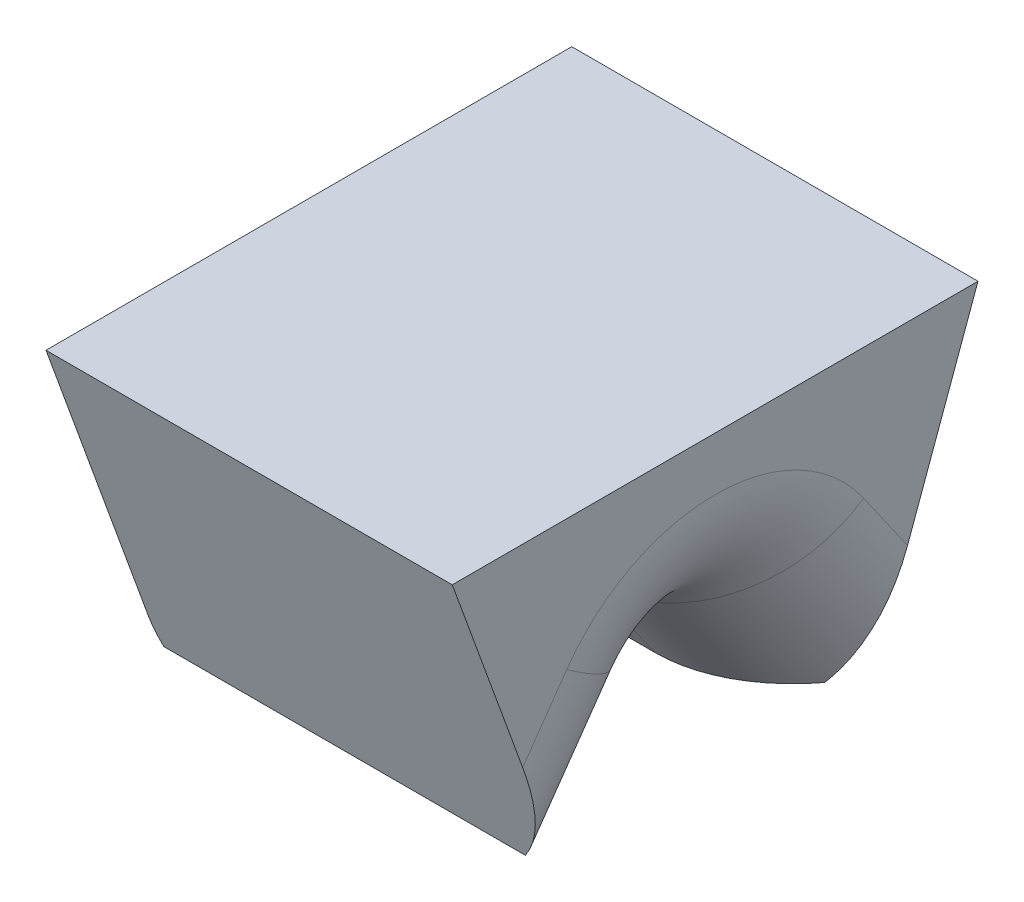
from build123d import *

# Parameters (mm, degrees)
SKETCH_TL_CUTTING_R    = 1.99771
TL_CUTTING_DEPTH       = 29.999999944
SKETCH_TDF_CUTTING_W   = 4.01541996
SKETCH_TDF_CUTTING_H   = 4.01541996
TDF_CUTTING_DEPTH      = 31.132734478
VW_VR_GRINDING_DEPTH   = 2.00770998
VW_VR_GRINDING_2_DEPTH = 2.00770998
ISA_GRINDING_DEPTH     = 2.00770998
SKETCH_PRE_FRX_BRX_W   = 0.93996002
SKETCH_PRE_FRX_BRX_H   = 0.78994
SKETCH_PRE_FRX_BRX_W_2 = 2.52443996
PRE_FRX_BRX_DEPTH      = 2.00770998
FA_BA_GRINDING_DEPTH   = 2.00770998
BR_EDM_R               = 0.09906
FR_EDM_R               = 0.20066


with BuildPart() as part:
    # sketch_TL_cutting → TL_cutting (new body)
    with BuildSketch(Plane(origin=(0, 0, 0), x_dir=(1, 0, 0), z_dir=(0, 1, 0))):
        with Locations(Location((0, 0, 0), (0, 0, 270))):
            Circle(SKETCH_TL_CUTTING_R)
    extrude(amount=TL_CUTTING_DEPTH)

    # sketch_TDF_cutting → TDF_cutting (cut, through all)
    with BuildSketch(Plane(origin=(0, 0, 0), x_dir=(1, 0, 0), z_dir=(0, 1, 0))):
        with Locations((-3.60917998, 0)):
            Rectangle(SKETCH_TDF_CUTTING_W, SKETCH_TDF_CUTTING_H)
    extrude(amount=TDF_CUTTING_DEPTH, mode=Mode.SUBTRACT)


with BuildPart() as body_2:
    # sketch_VW_VR_grinding → VW_VR_grinding (new, symmetric)
    with BuildSketch(Plane(origin=(0, 0, 0), x_dir=(0, 0, -1), z_dir=(1, 0, 0))):
        with BuildLine():
            Line((-1.59004, -0.00999998), (-1.59004, 9.977757879))
            ThreePointArc((-1.59004, 9.977757879), (-1.591006547, 9.999895438), (-1.593898831, 10.021864517))
            Line((-1.593898831, 10.021864517), (-2.01770996, 12.425416869))
            Line((-2.01770996, 12.425416869), (-2.00770998, -0.00999998))
            Line((-2.00770998, -0.00999998), (-1.59004, -0.00999998))
        make_face()
    extrude(amount=VW_VR_GRINDING_DEPTH, both=True)


with BuildPart() as body_3:
    # sketch_VW_VR_grinding → VW_VR_grinding 2 (new, symmetric)
    with BuildSketch(Plane(origin=(0, 0, 0), x_dir=(0, 0, -1), z_dir=(1, 0, 0))):
        with BuildLine():
            Line((1.59004, -0.00999998), (1.59004, 9.977757879))
            ThreePointArc((1.59004, 9.977757879), (1.591006547, 9.999895438), (1.593898831, 10.021864517))
            Line((1.593898831, 10.021864517), (2.01770996, 12.425416869))
            Line((2.01770996, 12.425416869), (2.00770998, -0.00999998))
            Line((2.00770998, -0.00999998), (1.59004, -0.00999998))
        make_face()
    extrude(amount=VW_VR_GRINDING_2_DEPTH, both=True)


    add(body_2.part)  # ISA_grinding merges body 2
    # sketch_ISA_grinding → ISA_grinding (add, symmetric)
    with BuildSketch(Plane(origin=(0, 0, 0), x_dir=(0, 0, -1), z_dir=(1, 0, 0))):
        Polygon((-0.19939, 0), (0.19939, 0), (2.00770998, 4.968318312), (2.00770998, -0.02999994), (-2.00770998, -0.02999994), (-2.00770998, 4.968318312), align=None)
    extrude(amount=ISA_GRINDING_DEPTH, both=True)

    # sketch_pre_FRX_BRX → pre_FRX_BRX (add, symmetric)
    with BuildSketch(Plane.XY):
        with Locations((1.52772999, 0.38497002)):
            Rectangle(SKETCH_PRE_FRX_BRX_W, SKETCH_PRE_FRX_BRX_H)
        with Locations((-0.75548998, 0.38497002)):
            Rectangle(SKETCH_PRE_FRX_BRX_W_2, SKETCH_PRE_FRX_BRX_H)
    extrude(amount=PRE_FRX_BRX_DEPTH, both=True)

    # sketch_FA_BA_grinding → FA_BA_grinding (add, symmetric)
    with BuildSketch(Plane.XY):
        Polygon((1.04775, -0.00999998), (1.04775, 0.78994), (2.12471, 8.452908576), (2.12471, -0.00999998), align=None)
        Polygon((0.50673, -0.00999998), (0.50673, 0.78994), (-1.72847, 16.694214403), (-1.72847, -0.00999998), align=None)
    extrude(amount=FA_BA_GRINDING_DEPTH, both=True)


with BuildPart() as part_1:
    add(part.part)

    # B1_fix: cut body 3
    add(body_3.part, mode=Mode.SUBTRACT)

    # V-Groove_EDM: sweep along a path in sketch_contour_V-Groove
    with BuildLine(Plane.XY) as v_groove_edm_path:
        Line((-1.60147, 0.14224), (1.99771, 0.14224))
    # sketch_section_V-Groove → V-Groove_EDM (sweep, cut)
    with BuildSketch(Plane(origin=(-1.60147, 0, -1.2954), x_dir=(0, 0, -1), z_dir=(1, 0, 0))):
        with BuildLine():
            Line((-1.262109661, 0.124910146), (-1.167644573, -0.00999998))
            Line((-1.167644573, -0.00999998), (-1.423155427, -0.00999998))
            Line((-1.423155427, -0.00999998), (-1.328690339, 0.124910146))
            ThreePointArc((-1.328690339, 0.124910146), (-1.2954, 0.14224), (-1.262109661, 0.124910146))
        make_face()
    sweep(path=v_groove_edm_path.line, mode=Mode.SUBTRACT)

    # BR_EDM
    br_edm_edges = [part_1.edges().sort_by_distance(p)[0] for p in [
        (0.50673, 0.14224, 0),
        (0.50673, 0.062455073, -0.077021852),
        (0.50673, 0.062455073, 0.077021852),
    ]]
    fillet(br_edm_edges, radius=BR_EDM_R)

    # FR_EDM
    fr_edm_edges = [part_1.edges().sort_by_distance(p)[0] for p in [
        (1.04775, 0.062455073, -0.077021852),
        (1.04775, 0.062455073, 0.077021852),
        (1.04775, 0.14224, 0),
    ]]
    fillet(fr_edm_edges, radius=FR_EDM_R)

    # SurfaceCut1
    split(bisect_by=Plane(origin=(0, 0.41401793, 0), x_dir=(1, 0, 0), z_dir=(0, 1, 0)), keep=Keep.BOTTOM)


solid = part_1.part
